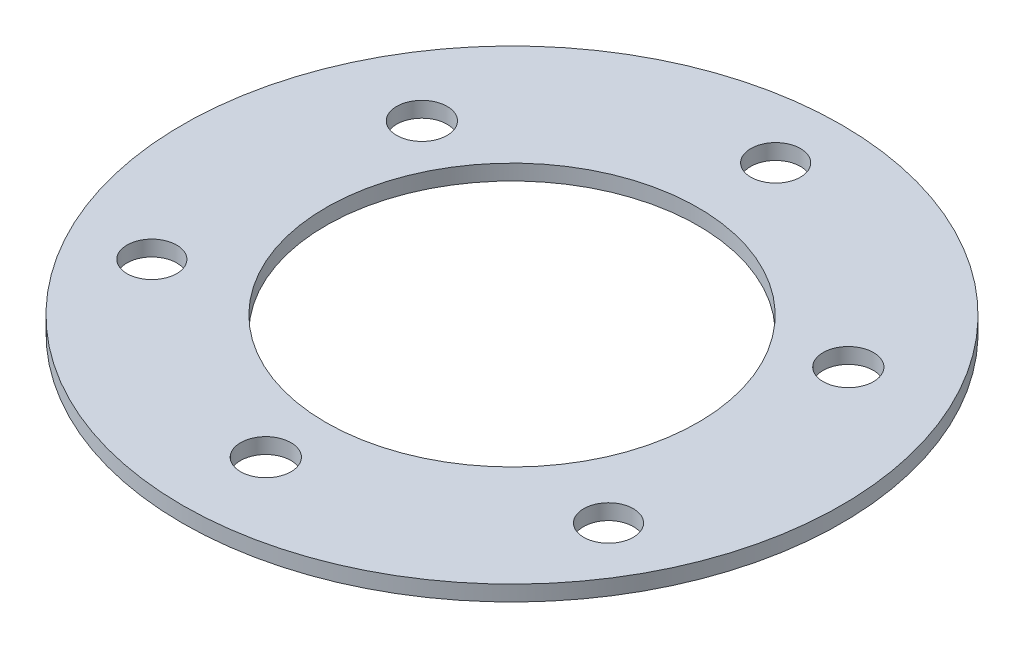
from build123d import *

# Parameters (mm, degrees)
SKETCH1_R           = 42.5
SKETCH1_R_2         = 24
BOSS_EXTRUDE1_DEPTH = 2
SKETCH3_R           = 3.25
SKETCH3_R_2         = 3.2
CUT_EXTRUDE1_DEPTH  = 2


with BuildPart() as part:
    # Sketch1 → Boss-Extrude1 (new body)
    with BuildSketch(Plane(origin=(0, 0, 0), x_dir=(1, 0, 0), z_dir=(0, 1, 0))):
        with Locations(Location((0, 0, 0), (0, 0, 270))):
            Circle(SKETCH1_R)
        with Locations(Location((0, 0, 0), (0, 0, 270))):
            Circle(SKETCH1_R_2, mode=Mode.SUBTRACT)
    extrude(amount=BOSS_EXTRUDE1_DEPTH)

    # Sketch3 → Cut-Extrude1 (cut)
    with BuildSketch(Plane(origin=(0, 2, 0), x_dir=(1, 0, 0), z_dir=(0, 1, 0))):
        with Locations(Location((0, -31.75, 0), (0, 0, 270))):
            Circle(SKETCH3_R)
        with Locations(Location((-27.49630657, 15.875, 0), (0, 0, 270))):
            Circle(SKETCH3_R)
        with Locations(Location((27.49630657, 15.875, 0), (0, 0, 270))):
            Circle(SKETCH3_R)
        with Locations(Location((0, 34, 0), (0, 0, 270))):
            Circle(SKETCH3_R_2)
        with Locations(Location((29.444863729, -17, 0), (0, 0, 270))):
            Circle(SKETCH3_R_2)
        with Locations(Location((-29.444863729, -17, 0), (0, 0, 270))):
            Circle(SKETCH3_R_2)
    extrude(amount=-CUT_EXTRUDE1_DEPTH, mode=Mode.SUBTRACT)


solid = part.part
